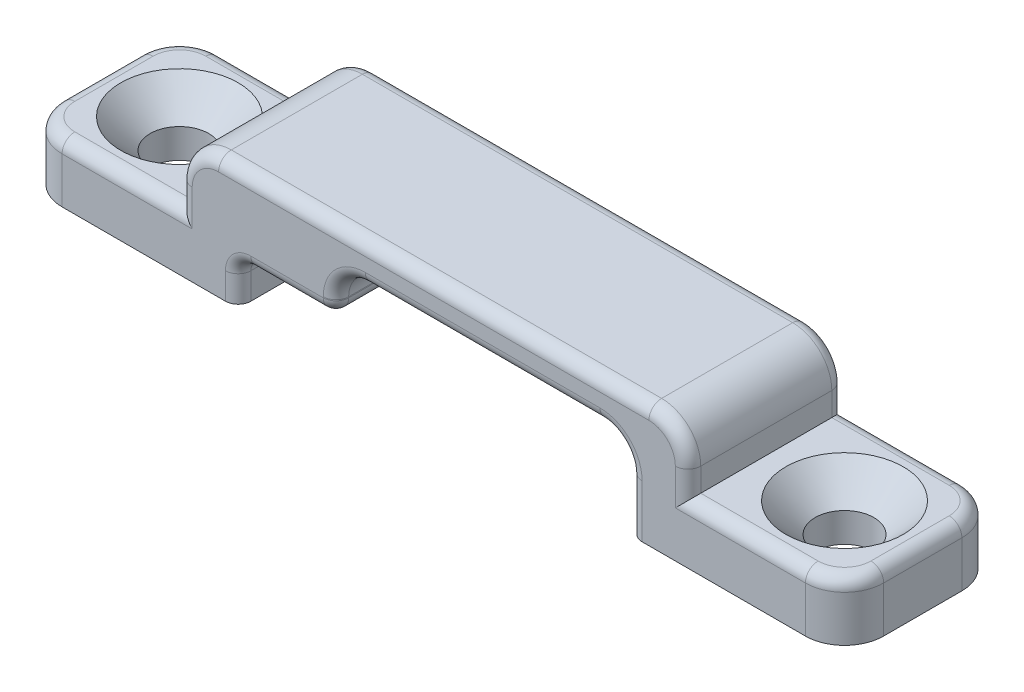
from build123d import *

# Parameters (mm, degrees)
RESSALTO_EXTRUS_O1_DEPTH = 8
ESBO_O2_R                = 1.5
CORTE_EXTRUS_O1_DEPTH    = 6
CHANFRO2_SIZE            = 1.5
FILETE1_R                = 2
FILETE2_R                = 1.5
FILETE3_R                = 0.65


with BuildPart() as part:
    # Esboço1 → Ressalto-extrusão1 (new body)
    with BuildSketch(Plane.XY):
        Polygon((-11.5, -1.2), (-11.5, 1.8), (-3.5, 1.8), (-3.5, 5), (22.5, 5), (22.5, 1.8), (30.5, 1.8), (30.5, -1.2), (19.5, -1.2), (19.5, 3), (4.5, 3), (4.5, 0.8), (-0.5, 0.8), (-0.5, -1.2), align=None)
    extrude(amount=RESSALTO_EXTRUS_O1_DEPTH)

    # Esboço2 → Corte-extrusão1 (cut)
    with BuildSketch(Plane(origin=(0, 1.8, 0), x_dir=(1, 0, 0), z_dir=(0, 1, 0))):
        with Locations(Location((-7.5, -4, 0), (0, 0, 180))):
            Circle(ESBO_O2_R)
        with Locations(Location((26.5, -4, 0), (0, 0, 180))):
            Circle(ESBO_O2_R)
    extrude(amount=-CORTE_EXTRUS_O1_DEPTH, mode=Mode.SUBTRACT)

    # Chanfro2
    chanfro2_edges = [part.edges().sort_by_distance(p)[0] for p in [
        (-6, 1.8, 4),
        (28, 1.8, 4),
    ]]
    chamfer(chanfro2_edges, length=CHANFRO2_SIZE)

    # Filete1
    filete1_edges = [part.edges().sort_by_distance(p)[0] for p in [
        (30.5, 0.3, 0),
        (-11.5, 0.3, 0),
        (-11.5, 0.3, 8),
        (-3.5, 5, 4),
        (22.5, 5, 4),
        (30.5, 0.3, 8),
    ]]
    fillet(filete1_edges, radius=FILETE1_R)

    # Filete2
    filete2_edges = [part.edges().sort_by_distance(p)[0] for p in [
        (19.5, 3, 4),
        (4.5, 3, 4),
    ]]
    fillet(filete2_edges, radius=FILETE2_R)

    # Filete3
    filete3_edges = [part.edges().sort_by_distance(p)[0] for p in [
        (12, 3, 0),
        (12, 3, 8),
        (19.5, 0.15, 0),
        (19.5, 0.15, 8),
        (4.939339828, 2.560660172, 0),
        (4.939339828, 2.560660172, 8),
        (19.060660172, 2.560660172, 0),
        (19.060660172, 2.560660172, 8),
        (4.5, 1.15, 0),
        (2, 0.8, 0),
        (-0.5, -0.2, 0),
        (-6.5, 1.8, 0),
        (22.5, 2.4, 0),
        (-6.5, 1.8, 8),
        (4.5, 0.8, 4),
        (-0.5, 0.8, 4),
        (-0.5, -0.2, 8),
        (2, 0.8, 8),
        (4.5, 1.15, 8),
        (30.5, 1.8, 4),
        (25.5, 1.8, 0),
        (25.5, 1.8, 8),
        (29.914213562, 1.8, 7.414213562),
        (29.914213562, 1.8, 0.585786438),
        (-3.5, 2.4, 0),
        (9.5, 5, 0),
        (-2.914213562, 4.414213562, 0),
        (21.914213562, 4.414213562, 0),
        (9.5, 5, 8),
        (-3.5, 2.4, 8),
        (-2.914213562, 4.414213562, 8),
        (21.914213562, 4.414213562, 8),
        (-11.5, 1.8, 4),
        (-10.914213562, 1.8, 7.414213562),
        (-10.914213562, 1.8, 0.585786438),
        (22.5, 2.4, 8),
    ]]
    fillet(filete3_edges, radius=FILETE3_R)


solid = part.part
